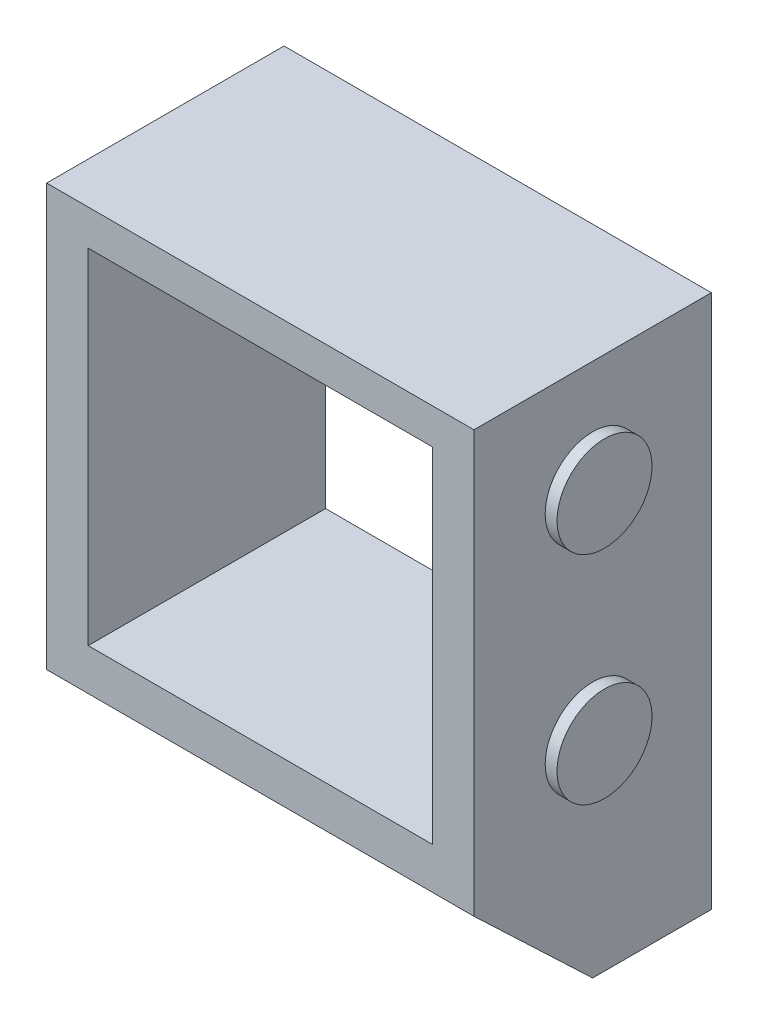
from build123d import *

# Parameters (mm, degrees)
SKETCH2_W                = 914.4
SKETCH2_H                = 1143
BOSS_EXTRUDE1_DEPTH      = 508
CUT_EXTRUDE1_DEPTH       = 1550.4
BOSS_EXTRUDE2_DEPTH      = 25.4
BOSS_EXTRUDE2_DEPTH_BACK = 939.8
SKETCH4_R                = 101.6
CUT_EXTRUDE2_REACH       = 1566.525
SKETCH5_W                = 736.6
SKETCH5_H                = 736.6


with BuildPart() as part:
    # Sketch2 → Boss-Extrude1 (new body)
    with BuildSketch(Plane.XY):
        with Locations((457.2, 571.5)):
            Rectangle(SKETCH2_W, SKETCH2_H)
    extrude(amount=BOSS_EXTRUDE1_DEPTH)

    # Sketch3 → Cut-Extrude1 (cut, through all)
    with BuildSketch(Plane(origin=(914.4, 0, 0), x_dir=(0, 0, -1), z_dir=(1, 0, 0))):
        Polygon((-508, 241.3), (-254, 0), (-508, 0), align=None)
    extrude(amount=-CUT_EXTRUDE1_DEPTH, mode=Mode.SUBTRACT)

    # Sketch4 → Boss-Extrude2 (add, two sides: drawn at the far end of the back side and taken through both)
    with BuildSketch(Plane(origin=(914.4, 0, 0), x_dir=(0, 0, -1), z_dir=(1, 0, 0)).offset(-BOSS_EXTRUDE2_DEPTH_BACK)):
        with Locations((-254, 910.669925226)):
            Circle(SKETCH4_R)
        with Locations((-254, 446.916916509)):
            Circle(SKETCH4_R)
    extrude(amount=BOSS_EXTRUDE2_DEPTH + BOSS_EXTRUDE2_DEPTH_BACK)

    # Sketch5 → Cut-Extrude2 (cut, up to next)
    with BuildSketch(Plane.XY.offset(508), mode=Mode.PRIVATE) as cut_extrude2_sk1:
        with Locations((457.2, 698.5)):
            Rectangle(SKETCH5_W, SKETCH5_H)
    cut_extrude2_tool1 = extrude(cut_extrude2_sk1.sketch, amount=-CUT_EXTRUDE2_REACH, mode=Mode.PRIVATE) & part.part
    add(cut_extrude2_tool1.solids().sort_by_distance((457.2, 698.5, 508))[0], mode=Mode.SUBTRACT)


solid = part.part
